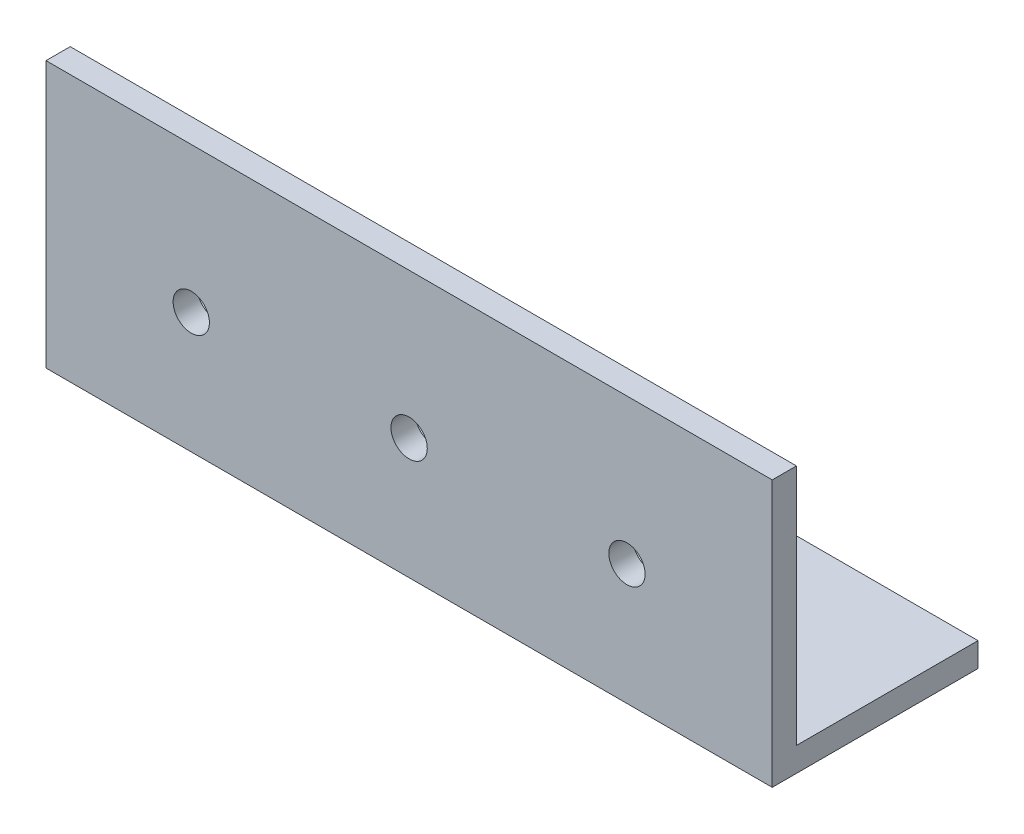
from build123d import *

# Parameters (mm, degrees)
BOSS_EXTRUDE1_DEPTH = 60
SKETCH2_R           = 1.5
CUT_EXTRUDE1_DEPTH  = 10
SKETCH3_R           = 1.5
CUT_EXTRUDE2_DEPTH  = 10


with BuildPart() as part:
    # Sketch1 → Boss-Extrude1 (new body)
    with BuildSketch(Plane(origin=(0, 0, 0), x_dir=(0, 0, -1), z_dir=(1, 0, 0))):
        Polygon((0, 0), (0, 22), (2, 22), (2, 2), (17, 2), (17, 0), align=None)
    extrude(amount=BOSS_EXTRUDE1_DEPTH)

    # Sketch2 → Cut-Extrude1 (cut)
    with BuildSketch(Plane.XZ):
        with Locations(Location((30, -8.5, 0), (0, 0, 270))):
            Circle(SKETCH2_R)
        with Locations(Location((12, -8.5, 0), (0, 0, 270))):
            Circle(SKETCH2_R)
        with Locations(Location((48, -8.5, 0), (0, 0, 270))):
            Circle(SKETCH2_R)
    extrude(amount=-CUT_EXTRUDE1_DEPTH, mode=Mode.SUBTRACT)

    # Sketch3 → Cut-Extrude2 (cut)
    with BuildSketch(Plane.XY):
        with Locations((30, 10)):
            Circle(SKETCH3_R)
        with Locations((12, 10)):
            Circle(SKETCH3_R)
        with Locations((48, 10)):
            Circle(SKETCH3_R)
    extrude(amount=-CUT_EXTRUDE2_DEPTH, mode=Mode.SUBTRACT)


solid = part.part
